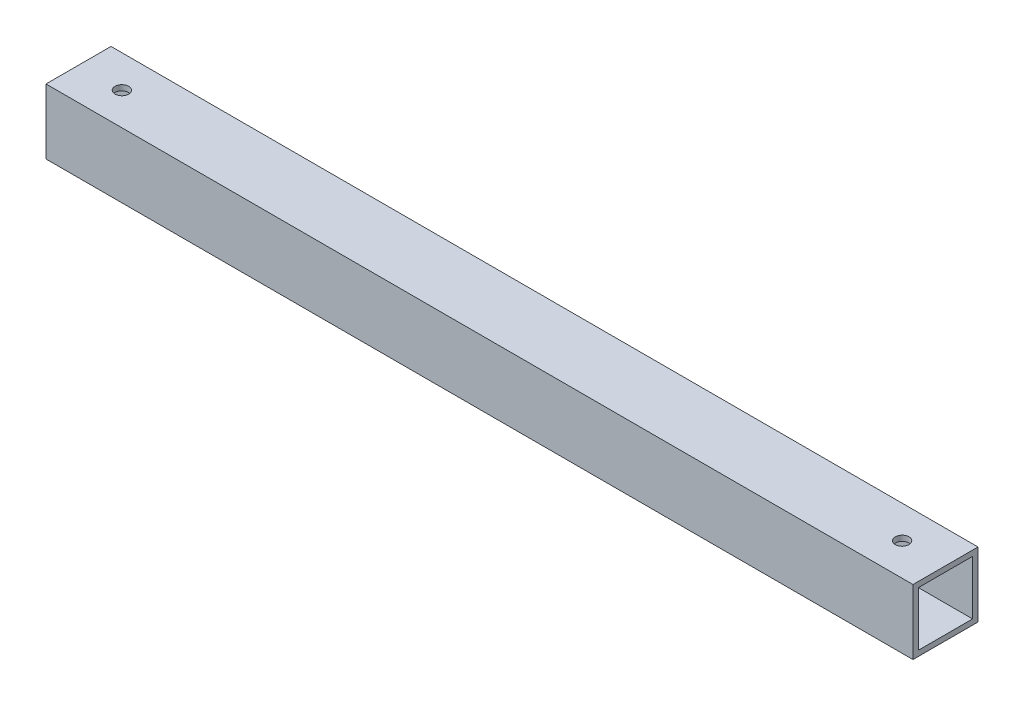
from build123d import *

# Parameters (mm, degrees)
SKETCH1_W           = 19.05
SKETCH1_H           = 19.05
SKETCH1_W_2         = 15.875
SKETCH1_H_2         = 15.875
BOSS_EXTRUDE1_DEPTH = 254
SKETCH2_R           = 2
CUT_EXTRUDE1_DEPTH  = 255.891404573


with BuildPart() as part:
    # Sketch1 → Boss-Extrude1 (new body)
    with BuildSketch(Plane(origin=(0, 0, 0), x_dir=(0, 0, -1), z_dir=(1, 0, 0))):
        Rectangle(SKETCH1_W, SKETCH1_H)
        Rectangle(SKETCH1_W_2, SKETCH1_H_2, mode=Mode.SUBTRACT)
    extrude(amount=BOSS_EXTRUDE1_DEPTH)

    # Sketch2 → Cut-Extrude1 (cut, through all)
    with BuildSketch(Plane(origin=(0, 9.525, 0), x_dir=(1, 0, 0), z_dir=(0, 1, 0))):
        with Locations(Location((12.7, 0, 0), (0, 0, 270))):
            Circle(SKETCH2_R)
        with Locations(Location((241.3, 0, 0), (0, 0, 270))):
            Circle(SKETCH2_R)
    extrude(amount=-CUT_EXTRUDE1_DEPTH, mode=Mode.SUBTRACT)


solid = part.part
